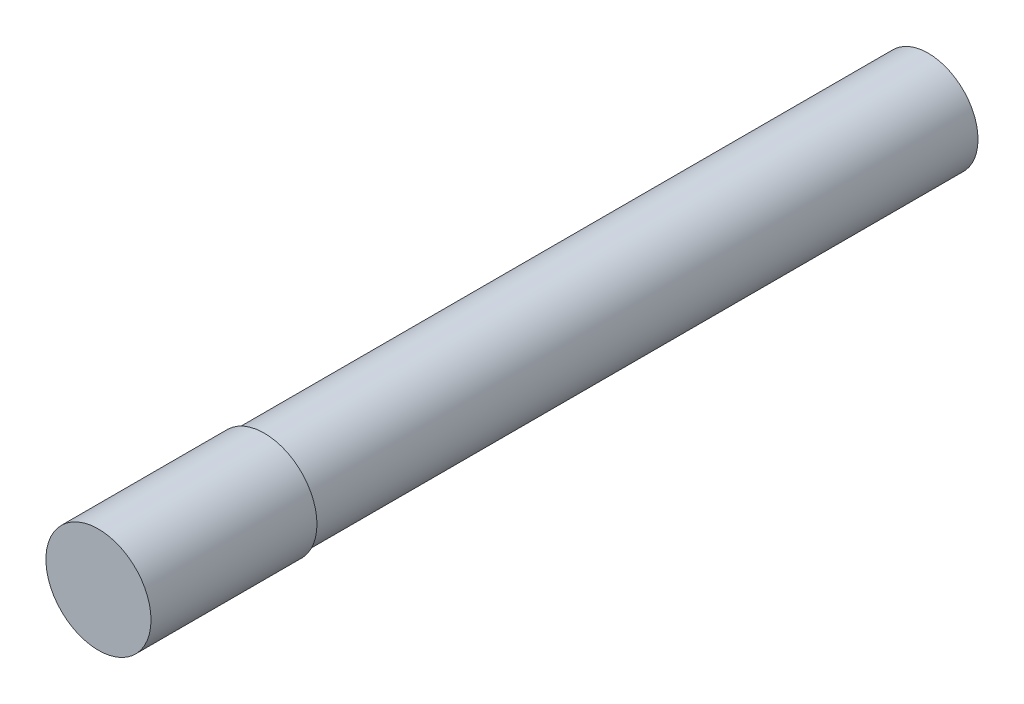
from build123d import *

# Parameters (mm, degrees)
SKETCH1_R    = 9
BARREL_DEPTH = 120
SKETCH2_R    = 9.5
CAP_DEPTH    = 30


with BuildPart() as part:
    # Sketch1 → Barrel (new body)
    with BuildSketch(Plane.XY):
        Circle(SKETCH1_R)
    extrude(amount=BARREL_DEPTH)

    # Sketch2 → Cap (add)
    with BuildSketch(Plane.XY.offset(120)):
        Circle(SKETCH2_R)
    extrude(amount=CAP_DEPTH)


solid = part.part
